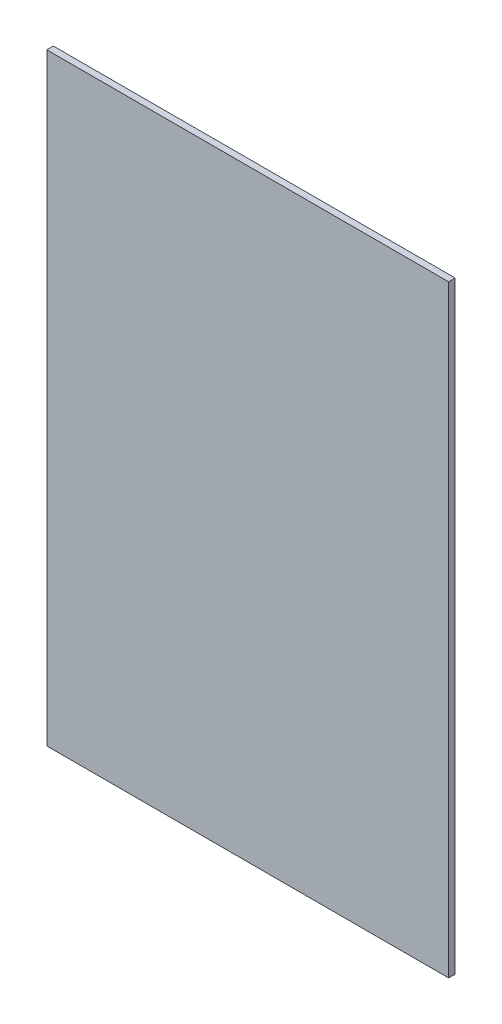
from build123d import *

# Parameters (mm, degrees)
SKETCH1_W           = 292.1
SKETCH1_H           = 438.15
BOSS_EXTRUDE1_DEPTH = 4.7625


with BuildPart() as part:
    # Sketch1 → Boss-Extrude1 (new body)
    with BuildSketch(Plane.XY):
        with Locations((146.05, -219.075)):
            Rectangle(SKETCH1_W, SKETCH1_H)
    extrude(amount=BOSS_EXTRUDE1_DEPTH)


solid = part.part
